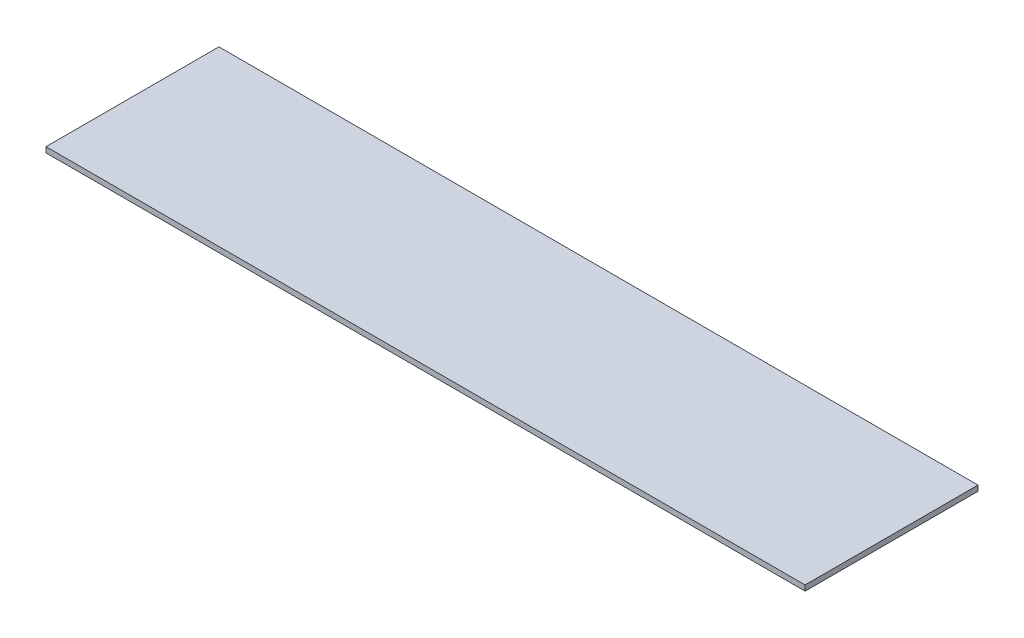
from build123d import *

# Parameters (mm, degrees)
SKETCH1_W           = 446
SKETCH1_H           = 101.6
BOSS_EXTRUDE1_DEPTH = 3.175


with BuildPart() as part:
    # Sketch1 → Boss-Extrude1 (new body)
    with BuildSketch(Plane(origin=(0, 0, 0), x_dir=(1, 0, 0), z_dir=(0, 1, 0))):
        with Locations((223, 50.8)):
            Rectangle(SKETCH1_W, SKETCH1_H)
    extrude(amount=BOSS_EXTRUDE1_DEPTH)


solid = part.part
